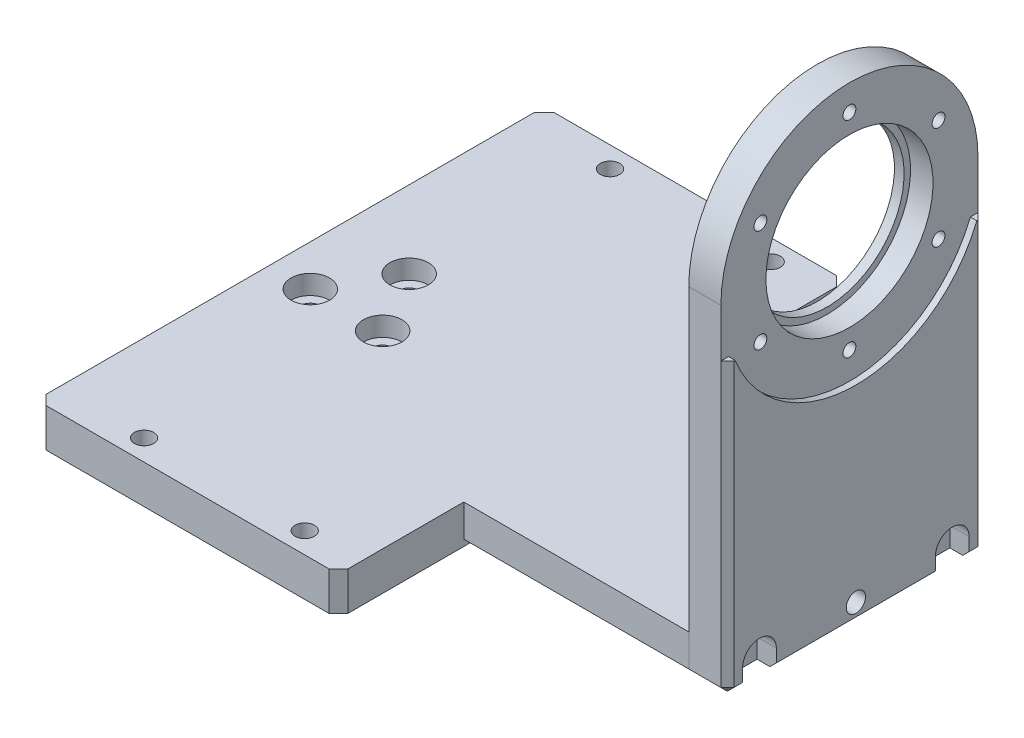
from build123d import *

# Parameters (mm, degrees)
SKETCH_10_R            = 3
EXTRUDE_5_DEPTH        = 12
SKETCH_11_R            = 3.1
CUT_EXTRUDE_5809_DEPTH = 116.935326799
SKETCH_12_R            = 6
CUT_EXTRUDE_3_DEPTH    = 6
SKETCH_13_R            = 3
CUT_EXTRUDE_6368_DEPTH = 15
CHAMFER_1_SIZE         = 3
CHAMFER_3_SIZE         = 2
SKETCH_14_R            = 26
SKETCH_14_R_2          = 3.1
EXTRUDE_6_DEPTH        = 12
SKETCH_19_R            = 26
SKETCH_19_R_2          = 24
EXTRUDE_7_DEPTH        = 3
CUT_EXTRUDE_7740_DEPTH = 6
CUT_EXTRUDE_6_DEPTH    = 2
SKETCH_17_R            = 2
CUT_EXTRUDE_M4_DEPTH   = 226.446224187
SKETCH_18_R            = 1.5
CUT_EXTRUDE_9319_DEPTH = 5.1
SKETCH_20_R            = 3
CUT_EXTRUDE_9634_DEPTH = 12
CHAMFER_2_SIZE         = 2


with BuildPart() as part:
    # ｽｹｯﾁ10 → ﾎﾞｽ - 押し出し5 (new body)
    with BuildSketch(Plane(origin=(0, 0, 0), x_dir=(1, 0, 0), z_dir=(0, 1, 0))):
        Polygon((-84, 79), (10, 79), (10, 40), (80, 40), (80, -40), (10, -40), (10, -79), (-84, -79), align=None)
        with Locations(Location((-57, 72.5, 0), (0, 0, 270))):
            Circle(SKETCH_10_R, mode=Mode.SUBTRACT)
        with Locations(Location((-7, 72.5, 0), (0, 0, 270))):
            Circle(SKETCH_10_R, mode=Mode.SUBTRACT)
        with Locations(Location((-57, -72.5, 0), (0, 0, 270))):
            Circle(SKETCH_10_R, mode=Mode.SUBTRACT)
        with Locations(Location((-7, -72.5, 0), (0, 0, 270))):
            Circle(SKETCH_10_R, mode=Mode.SUBTRACT)
    extrude(amount=-EXTRUDE_5_DEPTH)

    # ｽｹｯﾁ11 → Cut-Extrude 5809 (cut, through all)
    with BuildSketch(Plane(origin=(0, 0, 0), x_dir=(1, 0, 0), z_dir=(0, 1, 0))):
        with Locations(Location((-71.258330249, -6.5, 0), (0, 0, 270))):
            Circle(SKETCH_11_R)
        with Locations(Location((-60, 13, 0), (0, 0, 270))):
            Circle(SKETCH_11_R)
        with Locations(Location((-48.741669751, -6.5, 0), (0, 0, 270))):
            Circle(SKETCH_11_R)
    extrude(amount=-CUT_EXTRUDE_5809_DEPTH, mode=Mode.SUBTRACT)

    # ｽｹｯﾁ12 → ｶｯﾄ - 押し出し3 (cut)
    with BuildSketch(Plane(origin=(0, 0, 0), x_dir=(1, 0, 0), z_dir=(0, 1, 0))):
        with Locations(Location((-71.258330249, -6.5, 0), (0, 0, 270))):
            Circle(SKETCH_12_R)
        with Locations(Location((-60, 13, 0), (0, 0, 270))):
            Circle(SKETCH_12_R)
        with Locations(Location((-48.741669751, -6.5, 0), (0, 0, 270))):
            Circle(SKETCH_12_R)
    extrude(amount=-CUT_EXTRUDE_3_DEPTH, mode=Mode.SUBTRACT)

    # ｽｹｯﾁ13 → Cut-Extrude 6368 (cut)
    with BuildSketch(Plane(origin=(80, 0, 0), x_dir=(0, 0, -1), z_dir=(1, 0, 0))):
        with Locations((-30, -6)):
            Circle(SKETCH_13_R)
        with Locations(Location((30, -6, 0), (0, 0, 180))):
            Circle(SKETCH_13_R)
    extrude(amount=-CUT_EXTRUDE_6368_DEPTH, mode=Mode.SUBTRACT)

    # 面取り1
    chamfer_1_edges = [part.edges().sort_by_distance(p)[0] for p in [
        (-84, -6, -79),
        (10, -6, -79),
        (10, -6, 79),
        (-84, -6, 79),
    ]]
    chamfer(chamfer_1_edges, length=CHAMFER_1_SIZE)

    # 面取り3
    chamfer_3_edges = [part.edges().sort_by_distance(p)[0] for p in [
        (45, -12, 40),
        (45, -12, -40),
    ]]
    chamfer(chamfer_3_edges, length=CHAMFER_3_SIZE)


with BuildPart() as body_2:
    # ｽｹｯﾁ14 → ﾎﾞｽ - 押し出し6 (new body)
    with BuildSketch(Plane(origin=(80, 0, 0), x_dir=(0, 0, -1), z_dir=(1, 0, 0))):
        with BuildLine():
            Line((40, -12), (40, 0))
            Line((40, 0), (40, 93))
            ThreePointArc((40, 93), (0, 133), (-40, 93))
            Line((-40, 93), (-40, 0))
            Line((-40, 0), (-40, -12))
            Line((-40, -12), (40, -12))
        make_face()
        with Locations((0, 93)):
            Circle(SKETCH_14_R, mode=Mode.SUBTRACT)
        with Locations((-30, -6)):
            Circle(SKETCH_14_R_2, mode=Mode.SUBTRACT)
        with Locations((30, -6)):
            Circle(SKETCH_14_R_2, mode=Mode.SUBTRACT)
    extrude(amount=EXTRUDE_6_DEPTH)

    # ｽｹｯﾁ19 → ﾎﾞｽ - 押し出し7 (add)
    with BuildSketch(Plane.ZY.offset(-80)):
        with Locations((0, 93)):
            Circle(SKETCH_19_R)
        with Locations((0, 93)):
            Circle(SKETCH_19_R_2, mode=Mode.SUBTRACT)
    extrude(amount=-EXTRUDE_7_DEPTH)

    # ｽｹｯﾁ15 → Cut-Extrude 7740 (cut)
    with BuildSketch(Plane(origin=(92, 0, 0), x_dir=(0, 0, -1), z_dir=(1, 0, 0))):
        with BuildLine():
            Line((-24.75, -12), (-24.75, -6))
            ThreePointArc((-24.75, -6), (-30, -11.25), (-35.25, -6))
            Line((-35.25, -6), (-35.25, -12))
            Line((-35.25, -12), (-24.75, -12))
        make_face()
        with BuildLine():
            ThreePointArc((-33.1, -6), (-30, -2.9), (-26.9, -6))
            Line((-26.9, -6), (-24.75, -6))
            ThreePointArc((-24.75, -6), (-30, -0.75), (-35.25, -6))
            Line((-35.25, -6), (-33.1, -6))
        make_face()
        with BuildLine():
            Line((-24.75, -6), (-26.9, -6))
            ThreePointArc((-26.9, -6), (-30, -9.1), (-33.1, -6))
            Line((-33.1, -6), (-35.25, -6))
            ThreePointArc((-35.25, -6), (-30, -11.25), (-24.75, -6))
        make_face()
        with BuildLine():
            Line((24.75, -6), (24.75, -12))
            Line((24.75, -12), (35.25, -12))
            Line((35.25, -12), (35.25, -6))
            ThreePointArc((35.25, -6), (30, -11.25), (24.75, -6))
        make_face()
        with BuildLine():
            ThreePointArc((35.25, -6), (30, -0.75), (24.75, -6))
            Line((24.75, -6), (26.9, -6))
            ThreePointArc((26.9, -6), (30, -2.9), (33.1, -6))
            Line((33.1, -6), (35.25, -6))
        make_face()
        with BuildLine():
            Line((26.9, -6), (24.75, -6))
            ThreePointArc((24.75, -6), (30, -11.25), (35.25, -6))
            Line((35.25, -6), (33.1, -6))
            ThreePointArc((33.1, -6), (30, -9.1), (26.9, -6))
        make_face()
    extrude(amount=-CUT_EXTRUDE_7740_DEPTH, mode=Mode.SUBTRACT)

    # ｽｹｯﾁ16 → ｶｯﾄ - 押し出し6 (cut)
    with BuildSketch(Plane(origin=(92, 0, 0), x_dir=(0, 0, -1), z_dir=(1, 0, 0))):
        with BuildLine():
            Line((-40, 86.65571123), (-40, 78))
            Line((-40, 78), (-37.619808612, 78))
            ThreePointArc((-37.619808612, 78), (-39.050467429, 82.261704347), (-40, 86.65571123))
        make_face()
        with BuildLine():
            Line((-21.236760582, 78), (-37.619808612, 78))
            ThreePointArc((-37.619808612, 78), (0, 52.5), (37.619808612, 78))
            Line((37.619808612, 78), (21.236760582, 78))
            ThreePointArc((21.236760582, 78), (0, 67), (-21.236760582, 78))
        make_face()
        with BuildLine():
            ThreePointArc((-40, 86.65571123), (-39.050467429, 82.261704347), (-37.619808612, 78))
            Line((-37.619808612, 78), (-21.236760582, 78))
            ThreePointArc((-21.236760582, 78), (-7.869060455, 117.78059498), (26, 93))
            ThreePointArc((26, 93), (24.78059498, 85.130939545), (21.236760582, 78))
            Line((21.236760582, 78), (37.619808612, 78))
            ThreePointArc((37.619808612, 78), (39.050467429, 82.261704347), (40, 86.65571123))
            Line((40, 86.65571123), (40, 93))
            ThreePointArc((40, 93), (0, 133), (-40, 93))
            Line((-40, 93), (-40, 86.65571123))
        make_face()
        with BuildLine():
            ThreePointArc((40, 86.65571123), (39.050467429, 82.261704347), (37.619808612, 78))
            Line((37.619808612, 78), (40, 78))
            Line((40, 78), (40, 86.65571123))
        make_face()
    extrude(amount=-CUT_EXTRUDE_6_DEPTH, mode=Mode.SUBTRACT)

    # ｽｹｯﾁ17 → M4タップ (cut, through all)
    with BuildSketch(Plane.ZY.offset(-80)):
        with Locations((0, 125)):
            Circle(SKETCH_17_R)
        with Locations((27.712812921, 109)):
            Circle(SKETCH_17_R)
        with Locations((27.712812921, 77)):
            Circle(SKETCH_17_R)
        with Locations((0, 61)):
            Circle(SKETCH_17_R)
        with Locations((-27.712812921, 109)):
            Circle(SKETCH_17_R)
        with Locations((-27.712812921, 77)):
            Circle(SKETCH_17_R)
    extrude(amount=-CUT_EXTRUDE_M4_DEPTH, mode=Mode.SUBTRACT)


with BuildPart() as cut_extrude_9319_tool:
    # ｽｹｯﾁ18 → Cut-Extrude 9319 (new, symmetric)
    with BuildSketch(Plane.ZY.offset(-80)):
        with Locations((-20, -6)):
            Circle(SKETCH_18_R)
        with Locations(Location((20, -6, 0), (0, 0, 180))):
            Circle(SKETCH_18_R)
    extrude(amount=CUT_EXTRUDE_9319_DEPTH, both=True)


with BuildPart() as part_1:
    add(part.part)

    # Cut-Extrude 9319: cut by cut_extrude_9319_tool
    add(cut_extrude_9319_tool.part, mode=Mode.SUBTRACT)


with BuildPart() as body_2_1:
    add(body_2.part)

    # Cut-Extrude 9319: cut by cut_extrude_9319_tool
    add(cut_extrude_9319_tool.part, mode=Mode.SUBTRACT)

    # ｽｹｯﾁ20 → Cut-Extrude 9634 (cut)
    with BuildSketch(Plane(origin=(92, 0, 0), x_dir=(0, 0, -1), z_dir=(1, 0, 0))):
        with Locations((0, -6)):
            Circle(SKETCH_20_R)
    extrude(amount=-CUT_EXTRUDE_9634_DEPTH, mode=Mode.SUBTRACT)

    # 面取り2
    chamfer_2_edges = [body_2_1.edges().sort_by_distance(p)[0] for p in [
        (92, 33, 40),
        (92, -12, 37.625),
        (92, -12, 0),
        (92, -12, -37.625),
        (92, 33, -40),
        (86, -12, 40),
        (86, -12, -40),
    ]]
    chamfer(chamfer_2_edges, length=CHAMFER_2_SIZE)


solid = Compound([part_1.part, body_2_1.part])
